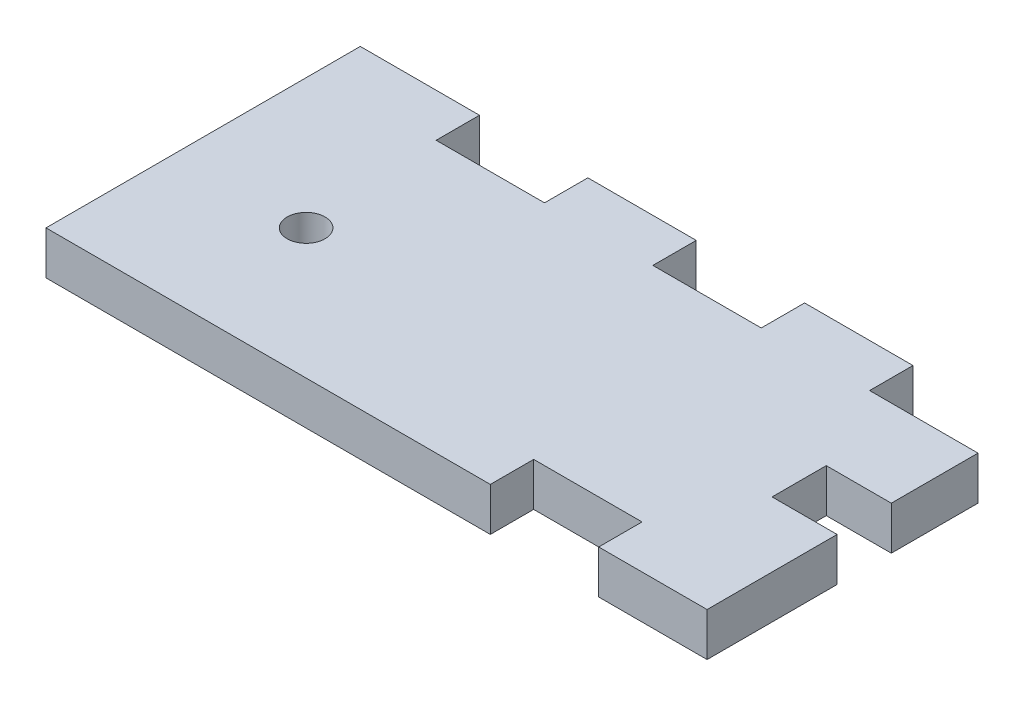
from build123d import *

# Parameters (mm, degrees)
SKETCH1_W           = 55
SKETCH1_H           = 21
BOSS_EXTRUDE1_DEPTH = 4
SKETCH2_W           = 8
SKETCH2_H           = 4
BOSS_EXTRUDE2_DEPTH = 6
SKETCH3_W           = 10
SKETCH3_H           = 4
BOSS_EXTRUDE3_DEPTH = 4
LPATTERN1_COUNT     = 3
LPATTERN1_PITCH     = 20
SKETCH4_W           = 1
SKETCH4_H           = 4
BOSS_EXTRUDE4_DEPTH = 4
SKETCH5_W           = 41
SKETCH5_H           = 4
SKETCH5_W_2         = 10
BOSS_EXTRUDE5_DEPTH = 4
SKETCH6_R           = 1.75
CUT_EXTRUDE1_DEPTH  = 67.045438904


with BuildPart() as part:
    # Sketch1 → Boss-Extrude1 (new body)
    with BuildSketch(Plane(origin=(0, 0, 0), x_dir=(1, 0, 0), z_dir=(0, 1, 0))):
        with Locations((27.5, -10.5)):
            Rectangle(SKETCH1_W, SKETCH1_H)
    extrude(amount=BOSS_EXTRUDE1_DEPTH)

    # Sketch2 → Boss-Extrude2 (add)
    with BuildSketch(Plane(origin=(55, 0, 0), x_dir=(0, 0, -1), z_dir=(1, 0, 0))):
        with Locations((-17, 2)):
            Rectangle(SKETCH2_W, SKETCH2_H)
        with Locations((-4, 2)):
            Rectangle(SKETCH2_W, SKETCH2_H)
    extrude(amount=BOSS_EXTRUDE2_DEPTH)

    # Sketch3 → Boss-Extrude3 (add, through all)
    with BuildSketch(Plane(origin=(0, 4, 0), x_dir=(1, 0, 0), z_dir=(0, 1, 0))):
        with Locations((46, 2)):
            Rectangle(SKETCH3_W, SKETCH3_H)
    boss_extrude3 = extrude(amount=-BOSS_EXTRUDE3_DEPTH)

    # LPattern1: Boss-Extrude3 ×3
    with Locations(*[(-i * LPATTERN1_PITCH, 0, 0) for i in range(1, LPATTERN1_COUNT)]):
        add(boss_extrude3)

    # Sketch4 → Boss-Extrude4 (add, through all)
    with BuildSketch(Plane(origin=(0, 4, 0), x_dir=(1, 0, 0), z_dir=(0, 1, 0))):
        with Locations((0.5, 2)):
            Rectangle(SKETCH4_W, SKETCH4_H)
    extrude(amount=-BOSS_EXTRUDE4_DEPTH)

    # Sketch5 → Boss-Extrude5 (add, through all)
    with BuildSketch(Plane(origin=(0, 4, 0), x_dir=(1, 0, 0), z_dir=(0, 1, 0))):
        with Locations((20.5, -23)):
            Rectangle(SKETCH5_W, SKETCH5_H)
        with Locations((56, -23)):
            Rectangle(SKETCH5_W_2, SKETCH5_H)
    extrude(amount=-BOSS_EXTRUDE5_DEPTH)

    # Sketch6 → Cut-Extrude1 (cut, through all)
    with BuildSketch(Plane(origin=(0, 4, 0), x_dir=(1, 0, 0), z_dir=(0, 1, 0))):
        with Locations(Location((12, -13, 0), (0, 0, 270))):
            Circle(SKETCH6_R)
    extrude(amount=-CUT_EXTRUDE1_DEPTH, mode=Mode.SUBTRACT)


solid = part.part
